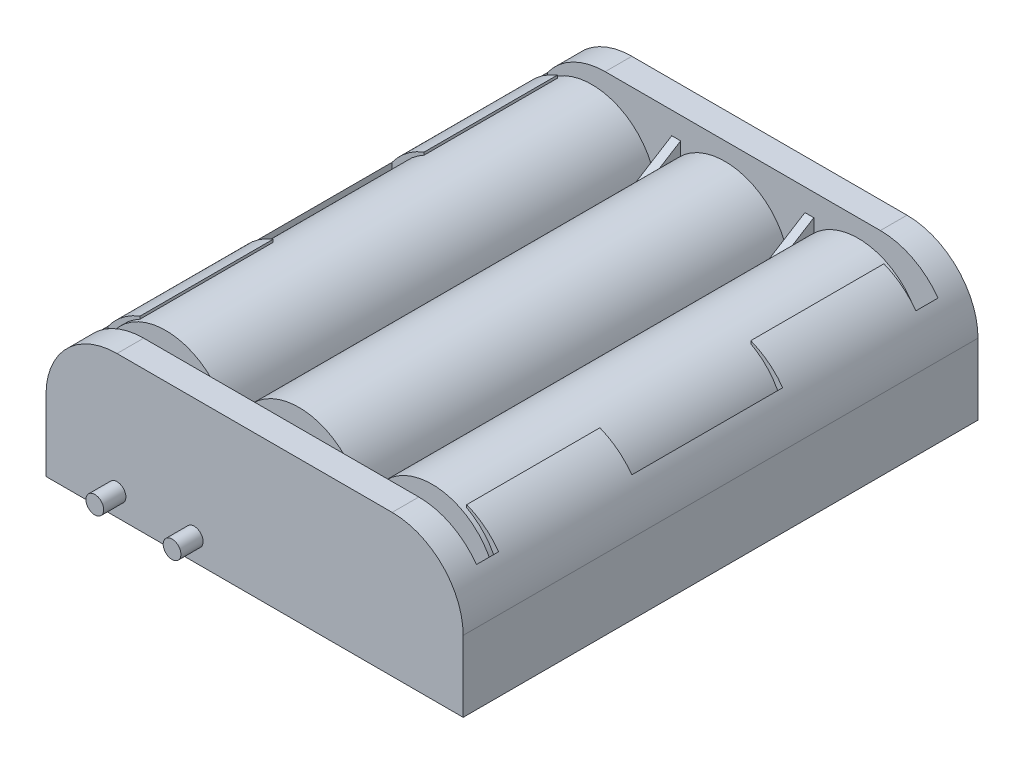
from build123d import *

# Parameters (mm, degrees)
SKETCH1_W           = 47
SKETCH1_H           = 58
BOSS_EXTRUDE1_DEPTH = 16
FILLET1_R           = 8
SKETCH2_W           = 14
SKETCH2_H           = 52
CUT_EXTRUDE1_DEPTH  = 14
CUT_EXTRUDE2_REACH  = 47.708
SKETCH4_R           = 7.25
BOSS_EXTRUDE3_DEPTH = 24
SKETCH5_R           = 2.4
SKETCH5_R_2         = 1.2
BOSS_EXTRUDE4_DEPTH = 1.5
SKETCH6_R           = 1
BOSS_EXTRUDE5_DEPTH = 2.5


with BuildPart() as part:
    # Sketch1 → Boss-Extrude1 (new body)
    with BuildSketch(Plane(origin=(0, 0, 0), x_dir=(1, 0, 0), z_dir=(0, 1, 0))):
        Rectangle(SKETCH1_W, SKETCH1_H)
    extrude(amount=BOSS_EXTRUDE1_DEPTH)

    # Fillet1
    fillet1_edges = [part.edges().sort_by_distance(p)[0] for p in [
        (-23.5, 16, 0),
        (23.5, 16, 0),
    ]]
    fillet(fillet1_edges, radius=FILLET1_R)

    # Sketch2 → Cut-Extrude1 (cut)
    with BuildSketch(Plane(origin=(0, 16, 0), x_dir=(1, 0, 0), z_dir=(0, 1, 0))):
        Polygon((-22, 26), (-8, 26), (-8, -26), (-22, -26), (-22, -23.5), (-18.4, -23.5), (-18.4, -8.5), (-22, -8.5), (-22, 8.5), (-18.4, 8.5), (-18.4, 23.5), (-22, 23.5), align=None)
        Rectangle(SKETCH2_W, SKETCH2_H)
        Polygon((8, 26), (22, 26), (22, 23.5), (18.4, 23.5), (18.4, 8.5), (22, 8.5), (22, -8.5), (18.4, -8.5), (18.4, -23.5), (22, -23.5), (22, -26), (8, -26), align=None)
    extrude(amount=-CUT_EXTRUDE1_DEPTH, mode=Mode.SUBTRACT)

    # Cut-Extrude2: up to this face of the body (flat: up to its plane)
    cut_extrude2_end = Plane(part.part.faces().sort_by_distance((-8, 9, 0))[0])
    # Sketch3 → Cut-Extrude2 (cut, up to the picked face)
    with BuildSketch(Plane(origin=(8, 0, 0), x_dir=(0, 0, -1), z_dir=(1, 0, 0)), mode=Mode.PRIVATE) as cut_extrude2_sk1:
        Polygon((-26, 16), (-26, 13.5), (-17.5, 8.2), (17.5, 8.2), (26, 13.5), (26, 16), align=None)
    cut_extrude2_tool1 = split(extrude(cut_extrude2_sk1.sketch, amount=-CUT_EXTRUDE2_REACH, mode=Mode.PRIVATE), bisect_by=cut_extrude2_end, keep=Keep.BOTH, mode=Mode.PRIVATE)
    add(cut_extrude2_tool1.solids().sort_by(Axis((8, 12.366556, 0), (-1, 0, 0)))[0], mode=Mode.SUBTRACT)

    # Sketch4 → Boss-Extrude3 (add, symmetric)
    with BuildSketch(Plane.XY):
        with Locations((-15, 8.75)):
            Circle(SKETCH4_R)
        with Locations((0, 8.75)):
            Circle(SKETCH4_R)
        with Locations((15, 8.75)):
            Circle(SKETCH4_R)
    extrude(amount=BOSS_EXTRUDE3_DEPTH, both=True)

    # Sketch5 → Boss-Extrude4 (add)
    # profile 1 of 3: a face of its own
    with BuildSketch(Plane.XZ):
        with Locations(Location((-19.6, 0, 0), (0, 0, 270))):
            Circle(SKETCH5_R)
        with Locations(Location((-19.6, 0, 0), (0, 0, 270))):
            Circle(SKETCH5_R_2, mode=Mode.SUBTRACT)
    # profile 2 of 3: a face of its own
    with BuildSketch(Plane.XZ):
        with Locations(Location((19.6, 0, 0), (0, 0, 90))):
            Circle(SKETCH5_R)
        with Locations(Location((19.6, 0, 0), (0, 0, 90))):
            Circle(SKETCH5_R_2, mode=Mode.SUBTRACT)
    # profile 3 of 3: a face of its own
    with BuildSketch(Plane.XZ):
        Polygon((-18.8, -26), (12.386677769, 26), (18.8, 26), (-12.386677769, -26), align=None)
    extrude(amount=BOSS_EXTRUDE4_DEPTH)

    # Sketch6 → Boss-Extrude5 (add)
    with BuildSketch(Plane.XY.offset(29)):
        with Locations(Location((-15.5, 2.5, 0), (0, 0, 180))):
            Circle(SKETCH6_R)
        with Locations(Location((-6.8, 2.5, 0), (0, 0, 180))):
            Circle(SKETCH6_R)
    extrude(amount=BOSS_EXTRUDE5_DEPTH)


solid = part.part
